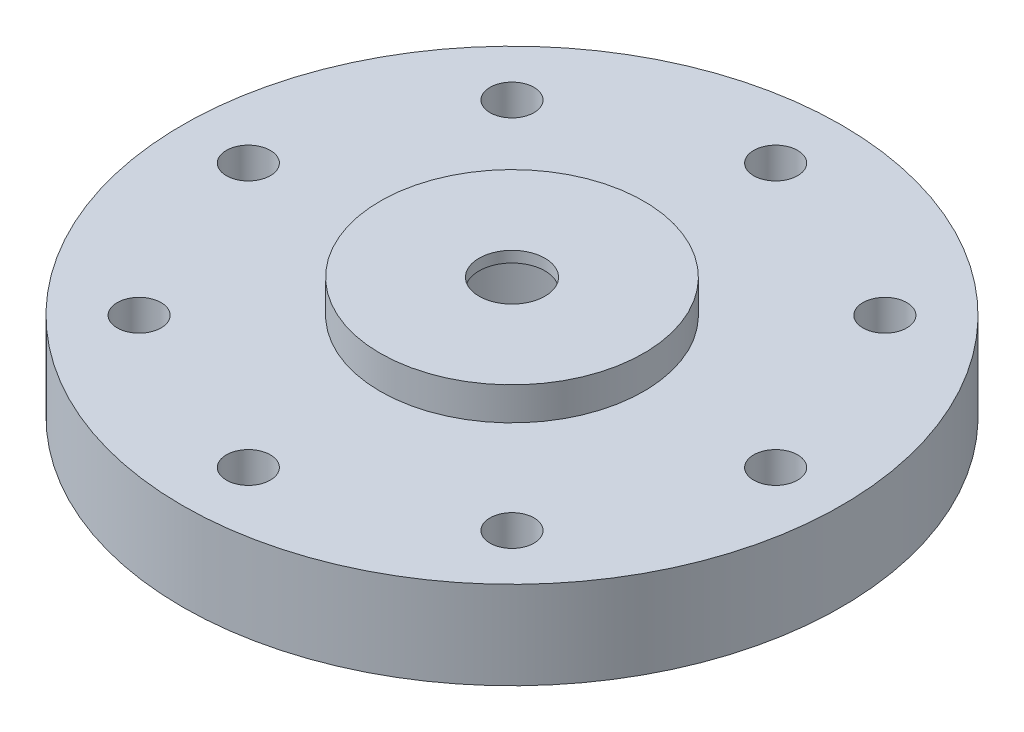
from build123d import *

# Parameters (mm, degrees)
SKETCH_1_R          = 15
SKETCH_1_R_2        = 1
SKETCH_1_R_3        = 1.5
EXTRUDE_1_DEPTH     = 4
SKETCH_2_R          = 6
SKETCH_2_R_2        = 1.5
EXTRUDE_2_DEPTH     = 1.5
SKETCH_3_R          = 4.5
CUT_EXTRUDE_1_DEPTH = 5


with BuildPart() as part:
    # 草图1 → 凸台-拉伸1 (new body)
    with BuildSketch(Plane(origin=(0, 0, 0), x_dir=(1, 0, 0), z_dir=(0, 1, 0))):
        with Locations(Location((0, 0, 0), (0, 0, 270))):
            Circle(SKETCH_1_R)
        with Locations(Location((0, 12, 0), (0, 0, 270))):
            Circle(SKETCH_1_R_2, mode=Mode.SUBTRACT)
        with Locations(Location((8.485281374, 8.485281374, 0), (0, 0, 270))):
            Circle(SKETCH_1_R_2, mode=Mode.SUBTRACT)
        with Locations(Location((8.485281374, -8.485281374, 0), (0, 0, 90))):
            Circle(SKETCH_1_R_2, mode=Mode.SUBTRACT)
        with Locations(Location((0, -12, 0), (0, 0, 90))):
            Circle(SKETCH_1_R_2, mode=Mode.SUBTRACT)
        with Locations(Location((-8.485281374, -8.485281374, 0), (0, 0, 270))):
            Circle(SKETCH_1_R_2, mode=Mode.SUBTRACT)
        with Locations(Location((-8.485281374, 8.485281374, 0), (0, 0, 90))):
            Circle(SKETCH_1_R_2, mode=Mode.SUBTRACT)
        with Locations(Location((-12, 0, 0), (0, 0, 270))):
            Circle(SKETCH_1_R_2, mode=Mode.SUBTRACT)
        with Locations(Location((12, 0, 0), (0, 0, 90))):
            Circle(SKETCH_1_R_2, mode=Mode.SUBTRACT)
        with Locations(Location((0, 0, 0), (0, 0, 270))):
            Circle(SKETCH_1_R_3, mode=Mode.SUBTRACT)
    extrude(amount=EXTRUDE_1_DEPTH)

    # 草图2 → 凸台-拉伸2 (add)
    with BuildSketch(Plane(origin=(0, 4, 0), x_dir=(1, 0, 0), z_dir=(0, 1, 0))):
        with Locations(Location((0, 0, 0), (0, 0, 270))):
            Circle(SKETCH_2_R)
        with Locations(Location((0, 0, 0), (0, 0, 270))):
            Circle(SKETCH_2_R_2, mode=Mode.SUBTRACT)
    extrude(amount=EXTRUDE_2_DEPTH)

    # 草图3 → 切除-拉伸1 (cut)
    with BuildSketch(Plane.XZ):
        with Locations(Location((0, 0, 0), (0, 0, 270))):
            Circle(SKETCH_3_R)
    extrude(amount=-CUT_EXTRUDE_1_DEPTH, mode=Mode.SUBTRACT)


solid = part.part
